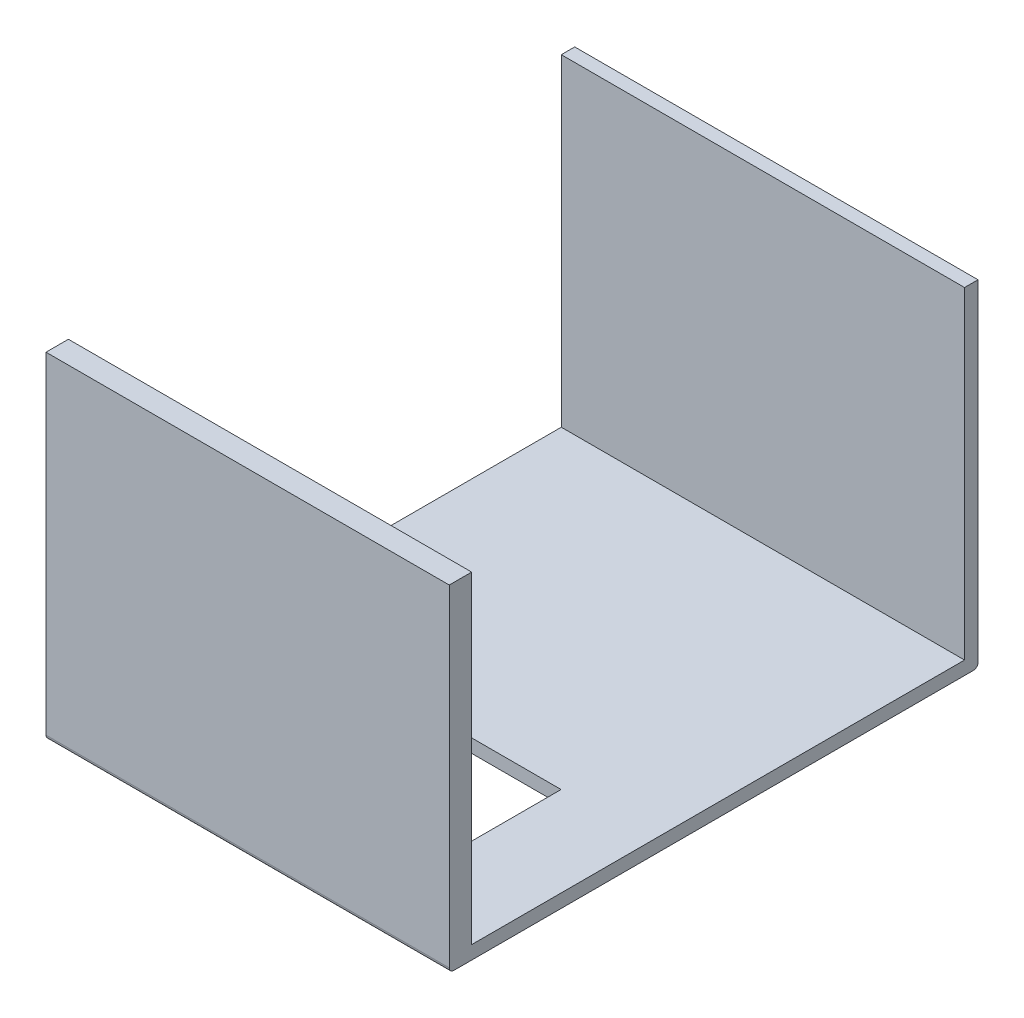
from build123d import *

# Parameters (mm, degrees)
ESBO_O1_W                = 90
ESBO_O1_H                = 110
RESSALTO_EXTRUS_O1_DEPTH = 3
ESBO_O2_W                = 50
ESBO_O2_H                = 39.951487405
CORTE_EXTRUS_O2_DEPTH    = 143.158362399
ESBO_O4_W                = 90
ESBO_O4_H                = 75
RESSALTO_EXTRUS_O2_DEPTH = 5
ESBO_O5_W                = 90
ESBO_O5_H                = 75
RESSALTO_EXTRUS_O3_DEPTH = 3
FILETE5_R                = 1


with BuildPart() as part:
    # Esboço1 → Ressalto-extrusão1 (new body)
    with BuildSketch(Plane(origin=(0, 0, 0), x_dir=(1, 0, 0), z_dir=(0, 1, 0))):
        with Locations((45, 55)):
            Rectangle(ESBO_O1_W, ESBO_O1_H)
    extrude(amount=RESSALTO_EXTRUS_O1_DEPTH)

    # Esboço2 → Corte-extrusão2 (cut, through all)
    with BuildSketch(Plane(origin=(0, 3, 0), x_dir=(1, 0, 0), z_dir=(0, 1, 0))):
        with Locations((45, 19.975743703)):
            Rectangle(ESBO_O2_W, ESBO_O2_H)
    extrude(amount=-CORTE_EXTRUS_O2_DEPTH, mode=Mode.SUBTRACT)

    # Esboço4 → Ressalto-extrusão2 (add)
    with BuildSketch(Plane.XY):
        with Locations((45, 37.5)):
            Rectangle(ESBO_O4_W, ESBO_O4_H)
    extrude(amount=RESSALTO_EXTRUS_O2_DEPTH)

    # Esboço5 → Ressalto-extrusão3 (add)
    with BuildSketch(Plane(origin=(0, 0, -110), x_dir=(-1, 0, 0), z_dir=(0, 0, -1))):
        with Locations((-45, 37.5)):
            Rectangle(ESBO_O5_W, ESBO_O5_H)
    extrude(amount=RESSALTO_EXTRUS_O3_DEPTH)

    # Filete5
    filete5_edges = [part.edges().sort_by_distance(p)[0] for p in [
        (45, 0, 5),
        (45, 0, -113),
    ]]
    fillet(filete5_edges, radius=FILETE5_R)


solid = part.part
